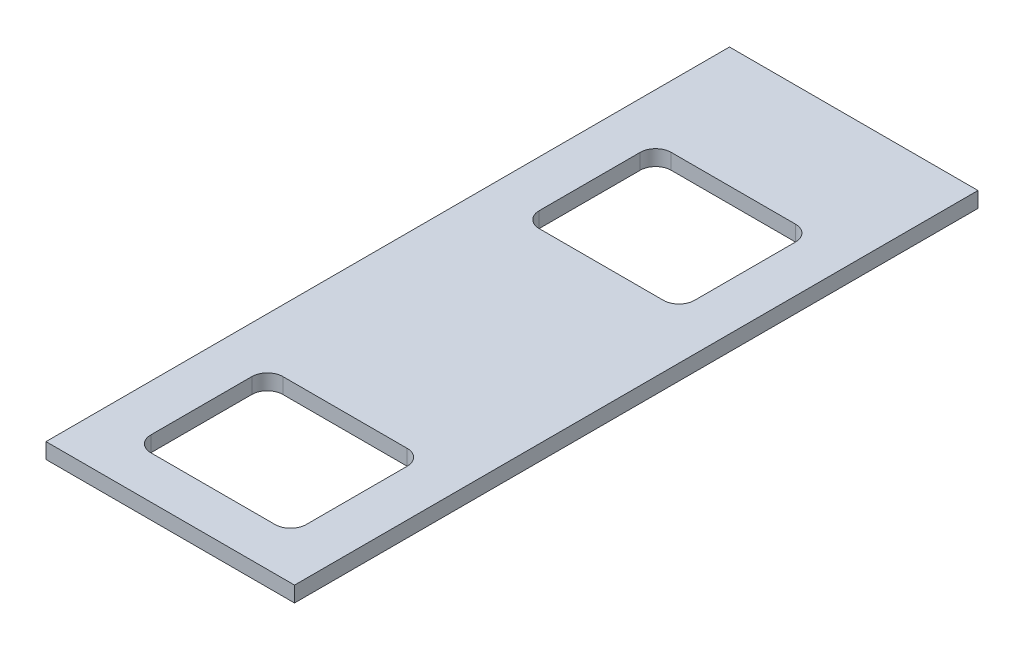
from build123d import *

# Parameters (mm, degrees)
SKETCH1_W               = 50.8
SKETCH1_H               = 50.8
BOSS_EXTRUDE1_DEPTH     = 69.85
SHELL1_T                = -3.175
SKETCH2_W               = 31.75
SKETCH2_H               = 26.9875
CUT_EXTRUDE1_DEPTH      = 79.545162168
FILLET1_R               = 3.175
CUT_EXTRUDE2_DEPTH      = 79.545162168
CUT_EXTRUDE2_DEPTH_BACK = 79.545162168
SKETCH3_R               = 3.175
CUT_EXTRUDE3_DEPTH      = 79.545162168
CUT_EXTRUDE3_DEPTH_BACK = 79.545162168
SKETCH4_R               = 2.4892
CUT_EXTRUDE4_DEPTH      = 79.545162168
CUT_EXTRUDE4_DEPTH_BACK = 79.545162168
SKETCH5_R               = 2.4892
FILLET2_R               = 3.175
SKETCH6_W               = 139.7
SKETCH6_H               = 47.625
CUT_EXTRUDE5_DEPTH      = 91.02678768


with BuildPart() as part:
    # Sketch1 → Boss-Extrude1 (new, symmetric)
    with BuildSketch(Plane.XY):
        Rectangle(SKETCH1_W, SKETCH1_H)
    extrude(amount=BOSS_EXTRUDE1_DEPTH, both=True)

    # Shell1
    shell1_openings = [part.faces().sort_by_distance(p)[0] for p in [
        (0, 0, 69.85),
        (0, 0, -69.85),
    ]]
    offset(amount=SHELL1_T, openings=shell1_openings, kind=Kind.INTERSECTION)

    # Sketch2 → Cut-Extrude1 (cut, through all)
    with BuildSketch(Plane(origin=(0, 0, 0), x_dir=(1, 0, 0), z_dir=(0, 1, 0))):
        with Locations((0, 31.75)):
            Rectangle(SKETCH2_W, SKETCH2_H)
        with Locations((0, -47.625)):
            Rectangle(SKETCH2_W, SKETCH2_H)
    extrude(amount=CUT_EXTRUDE1_DEPTH, mode=Mode.SUBTRACT)

    # Fillet1
    fillet1_edges = [part.edges().sort_by_distance(p)[0] for p in [
        (15.875, 23.8125, -18.25625),
        (15.875, 23.8125, -45.24375),
        (-15.875, 23.8125, -45.24375),
        (-15.875, 23.8125, -18.25625),
    ]]
    fillet(fillet1_edges, radius=FILLET1_R)

    # Sketch3 → Cut-Extrude2 (cut, two sides: drawn at the far end of the back side and taken through both)
    with BuildSketch(Plane(origin=(0, 0, 0), x_dir=(0, 0, -1), z_dir=(1, 0, 0)).offset(-CUT_EXTRUDE2_DEPTH_BACK)):
        with Locations((31.75, 9.525)):
            Circle(SKETCH3_R)
        with Locations((-44.45, 9.525)):
            Circle(SKETCH3_R)
    extrude(amount=CUT_EXTRUDE2_DEPTH + CUT_EXTRUDE2_DEPTH_BACK, mode=Mode.SUBTRACT)

    # Sketch4 → Cut-Extrude3 (cut, two sides: drawn at the far end of the back side and taken through both)
    with BuildSketch(Plane(origin=(0, 0, 0), x_dir=(0, 0, -1), z_dir=(1, 0, 0)).offset(-CUT_EXTRUDE3_DEPTH_BACK)):
        with Locations((57.15, 12.7)):
            Circle(SKETCH4_R)
        with Locations((44.45, -12.7)):
            Circle(SKETCH4_R)
        with Locations((31.75, -12.7)):
            Circle(SKETCH4_R)
        with Locations((19.05, -12.7)):
            Circle(SKETCH4_R)
        with Locations((57.15, 0)):
            Circle(SKETCH4_R)
        with Locations((57.15, -12.7)):
            Circle(SKETCH4_R)
        with Locations((-61.9125, 12.7)):
            Circle(SKETCH4_R)
        with Locations((-11.1125, 12.7)):
            Circle(SKETCH4_R)
        with Locations((-36.5125, -12.7)):
            Circle(SKETCH4_R)
        with Locations((-11.1125, -12.7)):
            Circle(SKETCH4_R)
        with Locations((-61.9125, -12.7)):
            Circle(SKETCH4_R)
    extrude(amount=CUT_EXTRUDE3_DEPTH + CUT_EXTRUDE3_DEPTH_BACK, mode=Mode.SUBTRACT)

    # Sketch5 → Cut-Extrude4 (cut, two sides: drawn at the far end of the back side and taken through both)
    with BuildSketch(Plane(origin=(0, 0, 0), x_dir=(1, 0, 0), z_dir=(0, 1, 0)).offset(-CUT_EXTRUDE4_DEPTH_BACK)):
        with Locations(Location((-12.7, -57.15, 0), (0, 0, 270))):
            Circle(SKETCH5_R)
        with Locations(Location((0, -57.15, 0), (0, 0, 270))):
            Circle(SKETCH5_R)
        with Locations(Location((12.7, -57.15, 0), (0, 0, 270))):
            Circle(SKETCH5_R)
    extrude(amount=CUT_EXTRUDE4_DEPTH + CUT_EXTRUDE4_DEPTH_BACK, mode=Mode.SUBTRACT)

    # Fillet2
    fillet2_edges = [part.edges().sort_by_distance(p)[0] for p in [
        (15.875, 23.8125, 61.11875),
        (15.875, 23.8125, 34.13125),
        (-15.875, 23.8125, 34.13125),
        (-15.875, 23.8125, 61.11875),
    ]]
    fillet(fillet2_edges, radius=FILLET2_R)

    # Sketch6 → Cut-Extrude5 (cut, through all)
    with BuildSketch(Plane(origin=(25.4, 0, 0), x_dir=(0, 0, -1), z_dir=(1, 0, 0))):
        with Locations((0, -1.5875)):
            Rectangle(SKETCH6_W, SKETCH6_H)
    extrude(amount=-CUT_EXTRUDE5_DEPTH, mode=Mode.SUBTRACT)


solid = part.part
